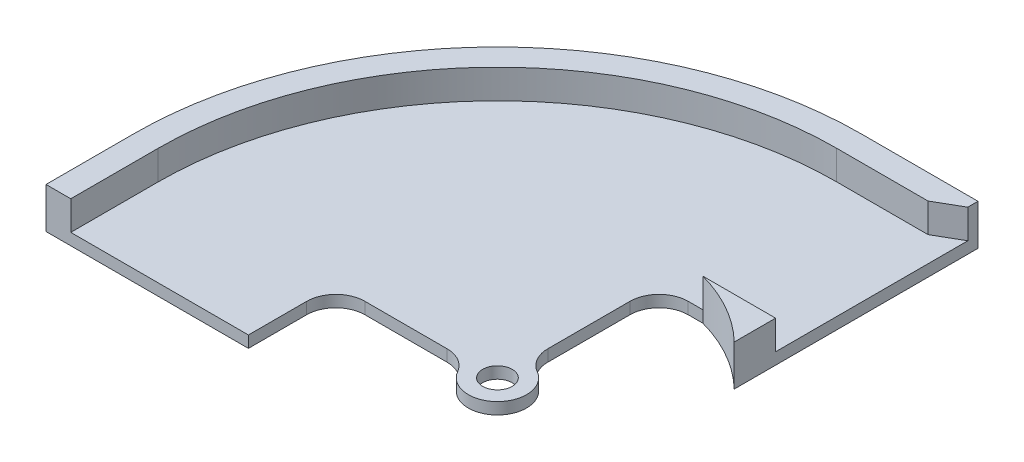
from build123d import *

# Parameters (mm, degrees)
SKETCH1_W           = 125
SKETCH1_H           = 125
BOSS_EXTRUDE1_DEPTH = 4
SKETCH7_W           = 40
SKETCH7_H           = 69.5
BOSS_EXTRUDE4_DEPTH = 4
SKETCH8_W           = 69.5
SKETCH8_H           = 30
BOSS_EXTRUDE5_DEPTH = 4
BOSS_EXTRUDE2_DEPTH = 10
SKETCH3_R           = 10
BOSS_EXTRUDE3_DEPTH = 4
SKETCH4_R           = 5.075
CUT_EXTRUDE1_DEPTH  = 4
FILLET1_R           = 125
CHAMFER1_SIZE       = 5
CHAMFER1_SIZE2      = 8.660254038
BOSS_EXTRUDE6_DEPTH = 14
FILLET2_R           = 10


with BuildPart() as part:
    # Sketch1 → Boss-Extrude1 (new body)
    with BuildSketch(Plane(origin=(0, 0, 0), x_dir=(1, 0, 0), z_dir=(0, 1, 0))):
        Rectangle(SKETCH1_W, SKETCH1_H)
    extrude(amount=BOSS_EXTRUDE1_DEPTH)

    # Sketch7 → Boss-Extrude4 (add)
    with BuildSketch(Plane(origin=(0, 0, 0), x_dir=(1, 0, 0), z_dir=(0, 1, 0))):
        with Locations((82.5, 27.75)):
            Rectangle(SKETCH7_W, SKETCH7_H)
    extrude(amount=BOSS_EXTRUDE4_DEPTH)

    # Sketch8 → Boss-Extrude5 (add)
    with BuildSketch(Plane(origin=(0, 0, 0), x_dir=(1, 0, 0), z_dir=(0, 1, 0))):
        with Locations((-27.75, -77.5)):
            Rectangle(SKETCH8_W, SKETCH8_H)
    extrude(amount=BOSS_EXTRUDE5_DEPTH)

    # Sketch2 → Boss-Extrude2 (add)
    with BuildSketch(Plane(origin=(0, 4, 0), x_dir=(1, 0, 0), z_dir=(0, 1, 0))):
        with BuildLine():
            Line((-62.5, -92.5), (-62.5, 62.5))
            Line((-62.5, 62.5), (102.5, 62.5))
            Line((102.5, 62.5), (102.5, 54))
            Line((102.5, 54), (62.5, 54))
            ThreePointArc((62.5, 54), (-19.877940008, 19.877940008), (-54, -62.5))
            Line((-54, -62.5), (-54, -92.5))
            Line((-54, -92.5), (-62.5, -92.5))
        make_face()
    extrude(amount=BOSS_EXTRUDE2_DEPTH)

    # Sketch3 → Boss-Extrude3 (add)
    with BuildSketch(Plane(origin=(0, 4, 0), x_dir=(1, 0, 0), z_dir=(0, 1, 0))):
        with Locations((62.5, -62.5)):
            Circle(SKETCH3_R)
    extrude(amount=-BOSS_EXTRUDE3_DEPTH)

    # Sketch4 → Cut-Extrude1 (cut)
    with BuildSketch(Plane(origin=(0, 4, 0), x_dir=(1, 0, 0), z_dir=(0, 1, 0))):
        with Locations(Location((62.5, -62.5, 0), (0, 0, 270))):
            Circle(SKETCH4_R)
    extrude(amount=-CUT_EXTRUDE1_DEPTH, mode=Mode.SUBTRACT)

    # Fillet1
    fillet1_edges = [part.edges().sort_by_distance(p)[0] for p in [
        (-62.5, 7, -62.5),
    ]]
    fillet(fillet1_edges, radius=FILLET1_R)

    # Chamfer1
    chamfer1_edges = [part.edges().sort_by_distance(p)[0] for p in [
        (102.5, 9, -54),
    ]]
    chamfer1_side = [part.faces().sort_by_distance(p)[0] for p in [
        (102.5, 3.639118457, -34.891873278),
    ]]
    chamfer(chamfer1_edges, length=CHAMFER1_SIZE, length2=CHAMFER1_SIZE2, reference=chamfer1_side[0])

    # Sketch9 → Boss-Extrude6 (add)
    with BuildSketch(Plane(origin=(0, 0, 0), x_dir=(1, 0, 0), z_dir=(0, 1, 0))):
        with BuildLine():
            Line((102.5, -7), (102.5, -21.193220895))
            ThreePointArc((102.5, -21.193220895), (90.917033755, -12.512779707), (77.533296378, -7))
            Line((77.533296378, -7), (102.5, -7))
        make_face()
    extrude(amount=BOSS_EXTRUDE6_DEPTH)

    # Fillet2
    fillet2_edges = [part.edges().sort_by_distance(p)[0] for p in [
        (62.5, 2, 7),
        (7, 2, 62.5),
        (62.5, 2, 52.5),
        (52.5, 2, 62.5),
    ]]
    fillet(fillet2_edges, radius=FILLET2_R)


solid = part.part
